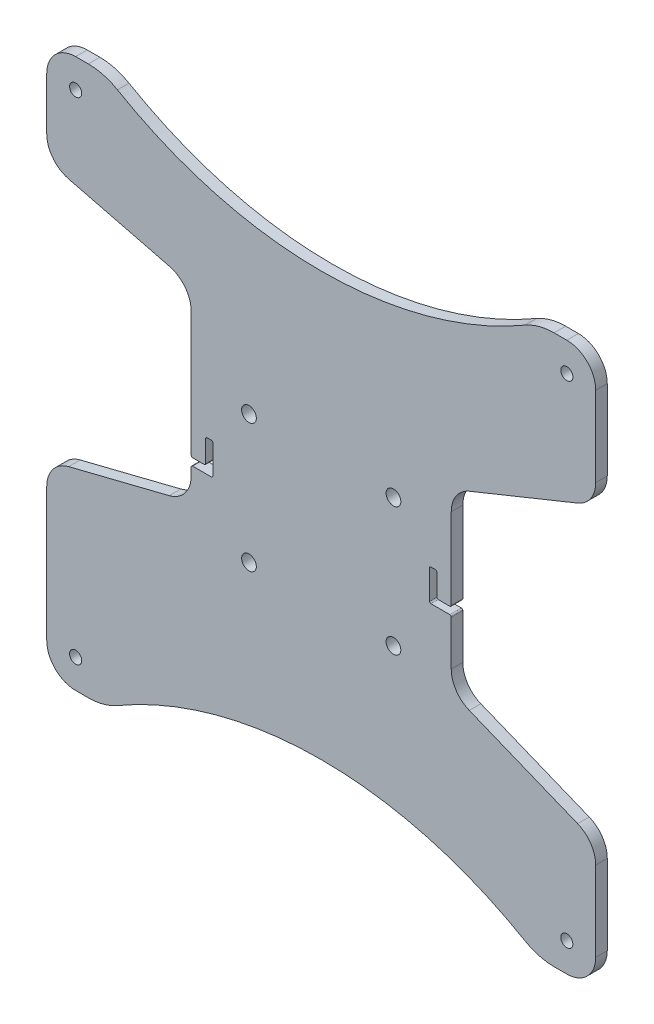
from build123d import *

# Parameters (mm, degrees)
SKETCH1_R           = 2.1
SKETCH1_R_2         = 2.55
SKETCH1_R_3         = 2.54
BOSS_EXTRUDE1_DEPTH = 4


with BuildPart() as part:
    # Sketch1 → Boss-Extrude1 (new body)
    with BuildSketch(Plane(origin=(0, 0, 0), x_dir=(-1, 0, 0), z_dir=(0, 0, -1))):
        with BuildLine():
            Line((87.42535625, -29.106339063), (52.57464375, -20.393660937))
            ThreePointArc((52.57464375, -20.393660937), (47.11794562, -16.84635803), (45, -10.692235936))
            Line((45, -10.692235936), (45, -8))
            ThreePointArc((45, -8), (44.853553391, -7.646446609), (44.5, -7.5))
            Line((44.5, -7.5), (38, -7.5))
            ThreePointArc((38, -7.5), (37.646446609, -7.353553391), (37.5, -7))
            Line((37.5, -7), (37.5, 3))
            ThreePointArc((37.5, 3), (37.646446609, 3.353553391), (38, 3.5))
            Line((38, 3.5), (39.5, 3.5))
            ThreePointArc((39.5, 3.5), (39.853553391, 3.353553391), (40, 3))
            Line((40, 3), (40, -4.5))
            ThreePointArc((40, -4.5), (40.146446609, -4.853553391), (40.5, -5))
            Line((40.5, -5), (44.5, -5))
            ThreePointArc((44.5, -5), (44.853553391, -4.853553391), (45, -4.5))
            Line((45, -4.5), (45, 38.692235936))
            ThreePointArc((45, 38.692235936), (47.11794562, 44.84635803), (52.57464375, 48.393660937))
            Line((52.57464375, 48.393660937), (87.42535625, 57.106339063))
            ThreePointArc((87.42535625, 57.106339063), (92.88205438, 60.65364197), (95, 66.807764064))
            Line((95, 66.807764064), (95, 85))
            ThreePointArc((95, 85), (92.071067812, 92.071067812), (85, 95))
            Line((85, 95), (80.600023778, 95))
            ThreePointArc((80.600023778, 95), (75.38177505, 94.307249421), (70.525020806, 92.276988022))
            ThreePointArc((70.525020806, 92.276988022), (0, 73.215904175), (-70.525020806, 92.276988022))
            ThreePointArc((-70.525020806, 92.276988022), (-75.38177505, 94.307249421), (-80.600023778, 95))
            Line((-80.600023778, 95), (-85, 95))
            ThreePointArc((-85, 95), (-92.071067812, 92.071067812), (-95, 85))
            Line((-95, 85), (-95, 57.30993956))
            ThreePointArc((-95, 57.30993956), (-93.292887614, 51.721736358), (-88.754396995, 48.041471336))
            Line((-88.754396995, 48.041471336), (-51.245603005, 32.847708996))
            ThreePointArc((-51.245603005, 32.847708996), (-46.707112386, 29.167443975), (-45, 23.579240773))
            Line((-45, 23.579240773), (-45, -4.5))
            ThreePointArc((-45, -4.5), (-44.853553391, -4.853553391), (-44.5, -5))
            Line((-44.5, -5), (-40.5, -5))
            ThreePointArc((-40.5, -5), (-40.146446609, -4.853553391), (-40, -4.5))
            Line((-40, -4.5), (-40, 3))
            ThreePointArc((-40, 3), (-39.853553391, 3.353553391), (-39.5, 3.5))
            Line((-39.5, 3.5), (-38, 3.5))
            ThreePointArc((-38, 3.5), (-37.646446609, 3.353553391), (-37.5, 3))
            Line((-37.5, 3), (-37.5, -7))
            ThreePointArc((-37.5, -7), (-37.646446609, -7.353553391), (-38, -7.5))
            Line((-38, -7.5), (-44.5, -7.5))
            ThreePointArc((-44.5, -7.5), (-44.853553391, -7.646446609), (-45, -8))
            Line((-45, -8), (-45, -23.579240773))
            ThreePointArc((-45, -23.579240773), (-46.707112386, -29.167443975), (-51.245603005, -32.847708996))
            Line((-51.245603005, -32.847708996), (-88.754396995, -48.041471336))
            ThreePointArc((-88.754396995, -48.041471336), (-93.292887614, -51.721736358), (-95, -57.30993956))
            Line((-95, -57.30993956), (-95, -85))
            ThreePointArc((-95, -85), (-92.071067812, -92.071067812), (-85, -95))
            Line((-85, -95), (-80.600023778, -95))
            ThreePointArc((-80.600023778, -95), (-75.38177505, -94.307249421), (-70.525020806, -92.276988022))
            ThreePointArc((-70.525020806, -92.276988022), (0, -73.215904175), (70.525020806, -92.276988022))
            ThreePointArc((70.525020806, -92.276988022), (75.38177505, -94.307249421), (80.600023778, -95))
            Line((80.600023778, -95), (85, -95))
            ThreePointArc((85, -95), (92.071067812, -92.071067812), (95, -85))
            Line((95, -85), (95, -38.807764064))
            ThreePointArc((95, -38.807764064), (92.88205438, -32.65364197), (87.42535625, -29.106339063))
        make_face()
        with Locations(Location((-85, -85, 0), (0, 0, 180))):
            Circle(SKETCH1_R, mode=Mode.SUBTRACT)
        with Locations(Location((-85, 85, 0), (0, 0, 180))):
            Circle(SKETCH1_R, mode=Mode.SUBTRACT)
        with Locations(Location((85, 85, 0), (0, 0, 180))):
            Circle(SKETCH1_R, mode=Mode.SUBTRACT)
        with Locations(Location((85, -85, 0), (0, 0, 180))):
            Circle(SKETCH1_R, mode=Mode.SUBTRACT)
        with Locations(Location((25, 17.873209062, 0), (0, 0, 180))):
            Circle(SKETCH1_R_2, mode=Mode.SUBTRACT)
        with Locations(Location((25, -26.606790938, 0), (0, 0, 180))):
            Circle(SKETCH1_R_3, mode=Mode.SUBTRACT)
        with Locations(Location((-25, -26.606790938, 0), (0, 0, 180))):
            Circle(SKETCH1_R_3, mode=Mode.SUBTRACT)
        with Locations(Location((-25, 17.873209062, 0), (0, 0, 180))):
            Circle(SKETCH1_R_2, mode=Mode.SUBTRACT)
    extrude(amount=-BOSS_EXTRUDE1_DEPTH)


solid = part.part
